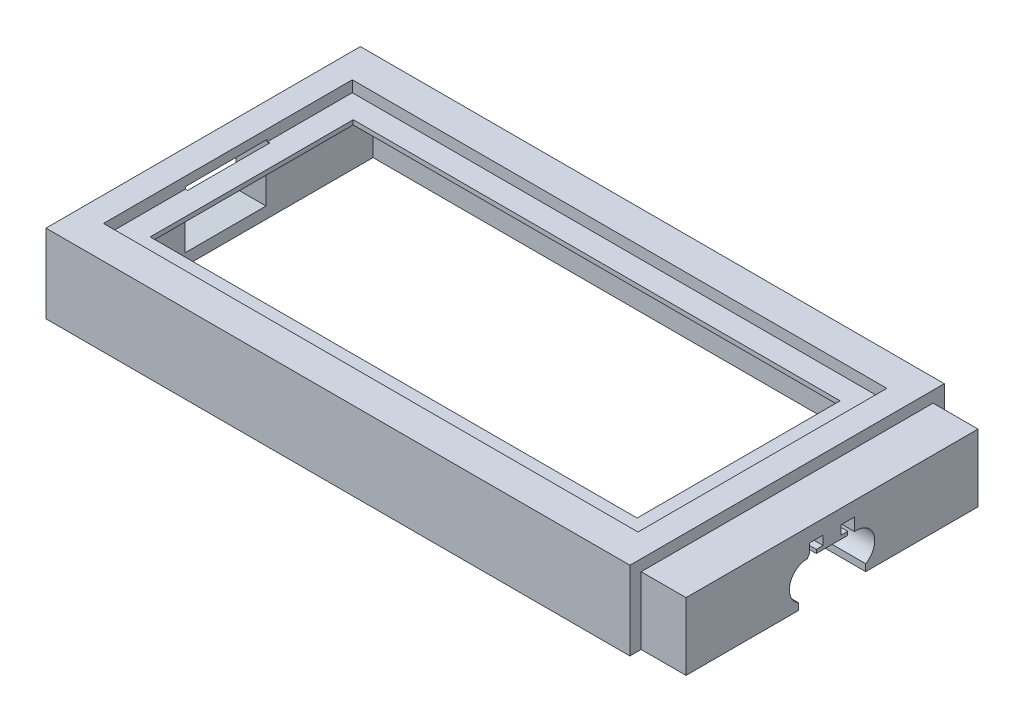
from build123d import *

# Parameters (mm, degrees)
SKETCH1_W           = 165.1
SKETCH1_H           = 88.9
BOSS_EXTRUDE1_DEPTH = 25.4
SKETCH2_W           = 82.55
SKETCH2_H           = 19.05
BOSS_EXTRUDE2_DEPTH = 12.7
SKETCH5_W           = 151.13
SKETCH5_H           = 70.358
CUT_EXTRUDE3_DEPTH  = 3.175
SKETCH7_W           = 165.1
SKETCH7_H           = 88.9
CUT_EXTRUDE4_DEPTH  = 3.175
CUT_EXTRUDE5_DEPTH  = 29.21
SKETCH11_W          = 142.477455076
SKETCH11_H          = 82.55
CUT_EXTRUDE7_DEPTH  = 17.78
SKETCH15_W          = 137.668
SKETCH15_H          = 57.404
CUT_EXTRUDE8_DEPTH  = 6.35
SKETCH19_W          = 12.7
SKETCH19_H          = 24.13
CUT_EXTRUDE9_DEPTH  = 17.78
SKETCH22_W          = 19.304
SKETCH22_H          = 12.7
CUT_EXTRUDE11_DEPTH = 7.62
CUT_EXTRUDE11_DRAFT = 15
SKETCH24_W          = 28.575
SKETCH24_H          = 19.05
CUT_EXTRUDE12_DEPTH = 5.08
CUT_EXTRUDE14_DEPTH = 30.48


with BuildPart() as part:
    # Sketch1 → Boss-Extrude1 (new body)
    with BuildSketch(Plane(origin=(0, 0, 0), x_dir=(1, 0, 0), z_dir=(0, 1, 0))):
        Rectangle(SKETCH1_W, SKETCH1_H)
    extrude(amount=BOSS_EXTRUDE1_DEPTH)

    # Sketch2 → Boss-Extrude2 (add)
    with BuildSketch(Plane(origin=(82.55, 0, 0), x_dir=(0, 0, -1), z_dir=(1, 0, 0))):
        with Locations((0, 12.7)):
            Rectangle(SKETCH2_W, SKETCH2_H)
    extrude(amount=BOSS_EXTRUDE2_DEPTH)

    # Sketch5 → Cut-Extrude3 (cut)
    with BuildSketch(Plane(origin=(0, 25.4, 0), x_dir=(1, 0, 0), z_dir=(0, 1, 0))):
        Rectangle(SKETCH5_W, SKETCH5_H)
    extrude(amount=-CUT_EXTRUDE3_DEPTH, mode=Mode.SUBTRACT)

    # Sketch7 → Cut-Extrude4 (cut)
    with BuildSketch(Plane.XZ):
        Rectangle(SKETCH7_W, SKETCH7_H)
    extrude(amount=-CUT_EXTRUDE4_DEPTH, mode=Mode.SUBTRACT)

    # Sketch9 → Cut-Extrude5 (cut)
    with BuildSketch(Plane(origin=(95.25, 0, 0), x_dir=(0, 0, -1), z_dir=(1, 0, 0))):
        with BuildLine():
            Line((6.985, 4.445), (-6.985, 4.445))
            ThreePointArc((-6.985, 4.445), (-12.065, 9.525), (-6.985, 14.605))
            Line((-6.985, 14.605), (6.985, 14.605))
            ThreePointArc((6.985, 14.605), (12.065, 9.525), (6.985, 4.445))
        make_face()
    extrude(amount=-CUT_EXTRUDE5_DEPTH, mode=Mode.SUBTRACT)

    # Sketch11 → Cut-Extrude7 (cut)
    with BuildSketch(Plane(origin=(0, 3.175, 0), x_dir=(-1, 0, 0), z_dir=(0, -1, 0))):
        with Locations((4.563727538, 0)):
            Rectangle(SKETCH11_W, SKETCH11_H)
    extrude(amount=-CUT_EXTRUDE7_DEPTH, mode=Mode.SUBTRACT)

    # Sketch15 → Cut-Extrude8 (cut)
    with BuildSketch(Plane(origin=(0, 22.225, 0), x_dir=(1, 0, 0), z_dir=(0, 1, 0))):
        Rectangle(SKETCH15_W, SKETCH15_H)
    extrude(amount=-CUT_EXTRUDE8_DEPTH, mode=Mode.SUBTRACT)

    # Sketch19 → Cut-Extrude9 (cut)
    with BuildSketch(Plane(origin=(0, 3.175, 0), x_dir=(-1, 0, 0), z_dir=(0, -1, 0))):
        with Locations((-73.025, -29.21)):
            Rectangle(SKETCH19_W, SKETCH19_H)
        with Locations((-73.025, 29.21)):
            Rectangle(SKETCH19_W, SKETCH19_H)
    extrude(amount=-CUT_EXTRUDE9_DEPTH, mode=Mode.SUBTRACT)


with BuildPart() as cut_extrude11_tool:
    # Sketch22 → Cut-Extrude11 (with draft: the straight prism first)
    with BuildSketch(Plane.ZY.offset(82.55)):
        with Locations((0.44501799, 14.605)):
            Rectangle(SKETCH22_W, SKETCH22_H)
    extrude(amount=-CUT_EXTRUDE11_DEPTH)
    # Cut-Extrude11: the draft: its side faces are tilted about the plane it starts from
    cut_extrude11_sides = [cut_extrude11_tool.faces().sort_by_distance(p)[0] for p in [
        (-78.74, 14.605, 10.09701799),
        (-78.74, 20.955, 0.44501799),
        (-78.74, 14.605, -9.20698201),
        (-78.74, 8.255, 0.44501799),
    ]]
    draft(cut_extrude11_sides, Plane.ZY.offset(82.55), CUT_EXTRUDE11_DRAFT)


with BuildPart() as part_1:
    add(part.part)

    # Cut-Extrude11: cut by cut_extrude11_tool
    add(cut_extrude11_tool.part, mode=Mode.SUBTRACT)

    # Sketch24 → Cut-Extrude12 (cut)
    with BuildSketch(Plane.XZ.offset(-3.175)):
        with Locations((80.9625, 0)):
            Rectangle(SKETCH24_W, SKETCH24_H)
    extrude(amount=-CUT_EXTRUDE12_DEPTH, mode=Mode.SUBTRACT)

    # Sketch27 → Cut-Extrude14 (cut)
    with BuildSketch(Plane(origin=(95.25, 0, 0), x_dir=(0, 0, -1), z_dir=(1, 0, 0))):
        Polygon((-6.985, 14.605), (-4.445, 14.605), (-4.445, 15.621), (-2.54, 15.621), (-2.54, 18.161), (-6.35, 18.161), (-6.35, 15.621), align=None)
        Polygon((2.54, 18.161), (2.54, 15.621), (4.445, 15.621), (4.445, 14.605), (6.35, 14.605), (6.35, 15.621), (6.35, 18.161), align=None)
    extrude(amount=-CUT_EXTRUDE14_DEPTH, mode=Mode.SUBTRACT)


solid = part_1.part
